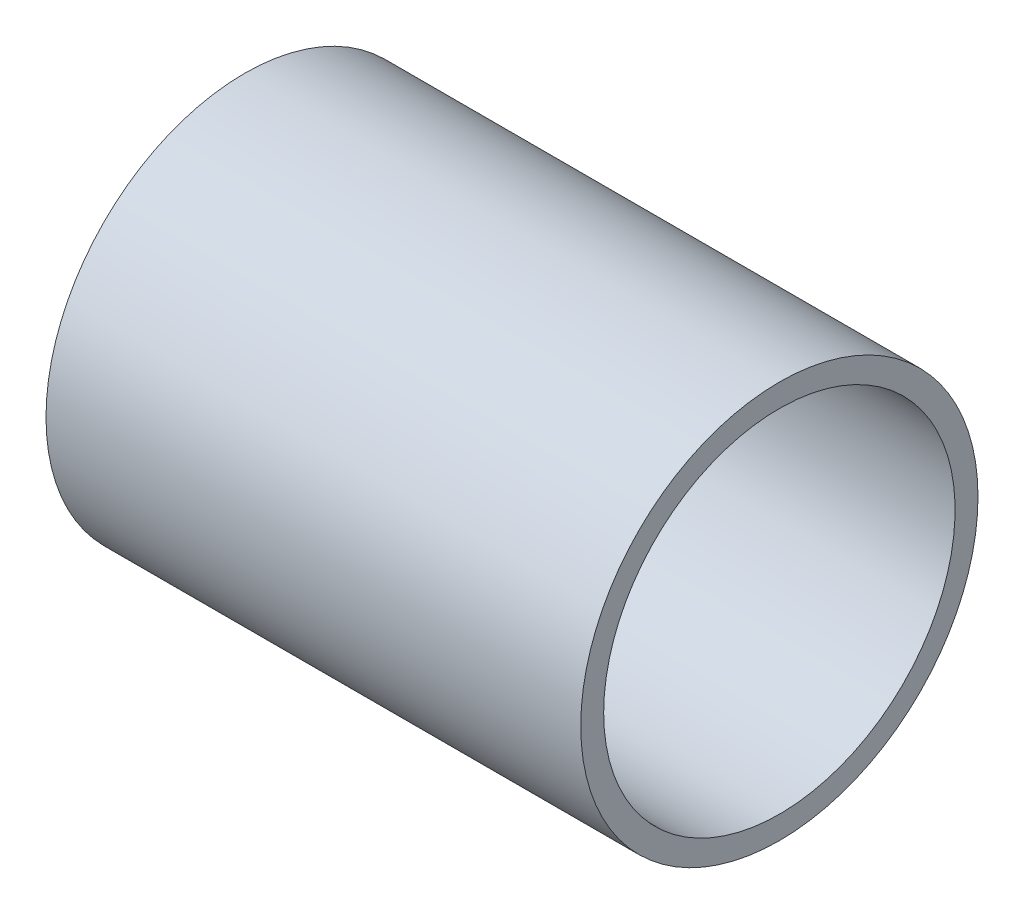
from build123d import *

# Parameters (mm, degrees)
SKETCH1_W = 70
SKETCH1_H = 3


with BuildPart() as part:
    # Sketch1 → Revolve1 (revolve)
    with BuildSketch(Plane.XY, mode=Mode.PRIVATE) as revolve1_sk:
        with Locations((35, 24.5)):
            Rectangle(SKETCH1_W, SKETCH1_H)
    revolve(revolve1_sk.sketch.rotate(Axis((0, 0, 0), (1, 0, 0)), 90), axis=Axis((0, 0, 0), (1, 0, 0)))


solid = part.part
